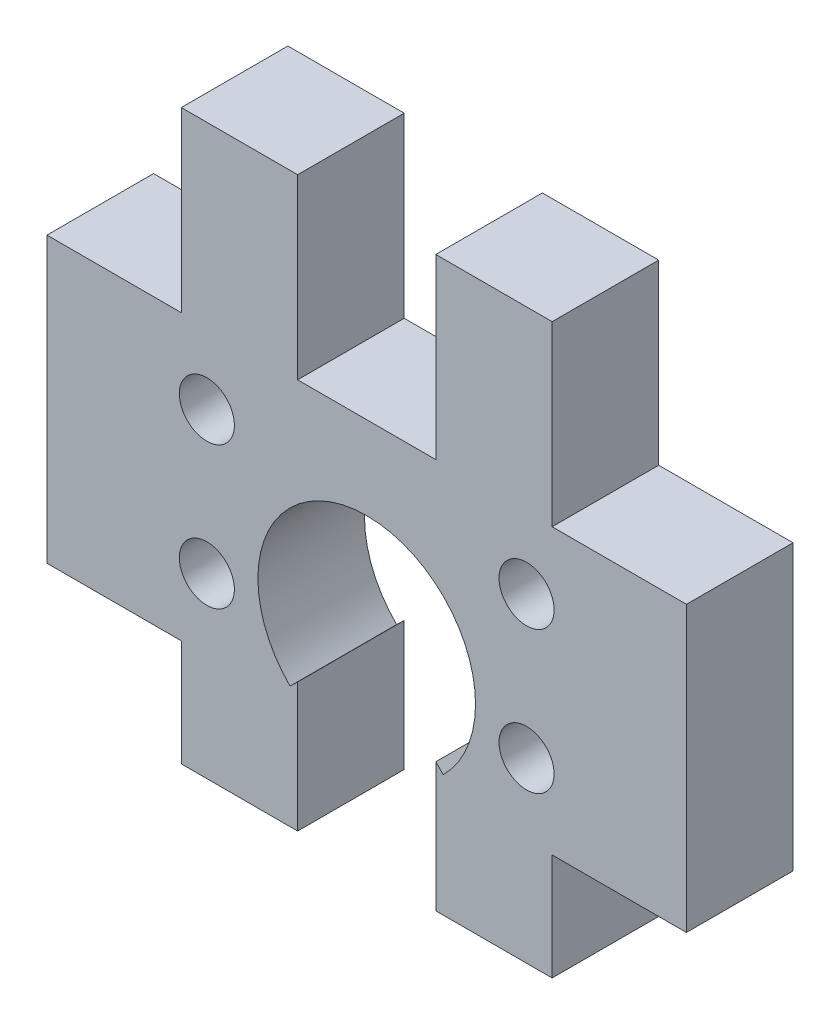
from build123d import *

# Parameters (mm, degrees)
SZKIC1_W                      = 36
SZKIC1_H                      = 16
DODANIE_WYCI_GNI_CIE1_DEPTH   = 6
WYTNIJ_WYCI_GNI_CIE1_DEPTH    = 6
SZKIC3_R                      = 1.55
WYTNIJ_WYCI_GNI_CIE2_DEPTH    = 74.51650454
SZKIC5_W                      = 6.55
SZKIC5_H                      = 6
DODANIE_WYCI_GNI_CIE2_DEPTH   = 6
DODANIE_WYCI_GNI_CIE2_2_DEPTH = 6
SZKIC7_W                      = 6.55
SZKIC7_H                      = 6
DODANIE_WYCI_GNI_CIE3_DEPTH   = 10


with BuildPart() as part:
    # Szkic1 → Dodanie-wyciągnięcie1 (new body)
    with BuildSketch(Plane.XY.offset(-64.000000001)):
        with Locations((53.502982034, -8)):
            Rectangle(SZKIC1_W, SZKIC1_H)
    extrude(amount=-DODANIE_WYCI_GNI_CIE1_DEPTH)

    # Szkic2 → Wytnij-wyciągnięcie1 (cut)
    with BuildSketch(Plane.XY.offset(-70.000000001)):
        with BuildLine():
            Line((49.614537615, -16), (49.614537615, -14.730541148))
            Line((49.614537615, -14.730541148), (49.186780246, -15.145805693))
            ThreePointArc((49.186780246, -15.145805693), (49.13517548, -15.093936528), (49.084193998, -15.041454619))
            ThreePointArc((49.084193998, -15.041454619), (53.502982034, -4.675), (57.921770071, -15.041454619))
            ThreePointArc((57.921770071, -15.041454619), (57.867648174, -15.097128633), (57.812824874, -15.152112096))
            Line((57.812824874, -15.152112096), (57.391426454, -14.730541148))
            Line((57.391426454, -14.730541148), (57.391426454, -16))
            Line((57.391426454, -16), (49.614537615, -16))
        make_face()
    extrude(amount=WYTNIJ_WYCI_GNI_CIE1_DEPTH, mode=Mode.SUBTRACT)

    # Szkic3 → Wytnij-wyciągnięcie2 (cut, through all)
    with BuildSketch(Plane(origin=(0, 0, -70.000000001), x_dir=(-1, 0, 0), z_dir=(0, 0, -1))):
        with Locations((-62.502982034, -4)):
            Circle(SZKIC3_R)
        with Locations((-44.502982034, -4)):
            Circle(SZKIC3_R)
        with Locations((-44.502982034, -12)):
            Circle(SZKIC3_R)
        with Locations((-62.502982034, -12)):
            Circle(SZKIC3_R)
    extrude(amount=-WYTNIJ_WYCI_GNI_CIE2_DEPTH, mode=Mode.SUBTRACT)


with BuildPart() as body_2:
    # Szkic5 → Dodanie-wyciągnięcie2 (new body)
    with BuildSketch(Plane.XZ.offset(16)):
        with Locations((60.666426454, -67.000000001)):
            Rectangle(SZKIC5_W, SZKIC5_H)
    extrude(amount=DODANIE_WYCI_GNI_CIE2_DEPTH)


with BuildPart() as body_3:
    # Szkic5 → Dodanie-wyci_gni_cie2 2 (new body)
    with BuildSketch(Plane.XZ.offset(16)):
        with Locations((46.339537615, -67.000000001)):
            Rectangle(SZKIC5_W, SZKIC5_H)
    extrude(amount=DODANIE_WYCI_GNI_CIE2_2_DEPTH)


with BuildPart() as part_1:
    add(part.part)

    # Połącz6: union body 2
    add(body_2.part)

    # Szkic7 → Dodanie-wyciągnięcie3 (add)
    with BuildSketch(Plane(origin=(0, 0, 0), x_dir=(1, 0, 0), z_dir=(0, 1, 0))):
        with Locations((60.666426454, 67.000000001)):
            Rectangle(SZKIC7_W, SZKIC7_H)
        with Locations((46.339537615, 67.000000001)):
            Rectangle(SZKIC7_W, SZKIC7_H)
    extrude(amount=DODANIE_WYCI_GNI_CIE3_DEPTH)


with BuildPart() as body_3_1:
    add(body_3.part)

    # Połącz8: union part
    add(part_1.part)


solid = body_3_1.part
